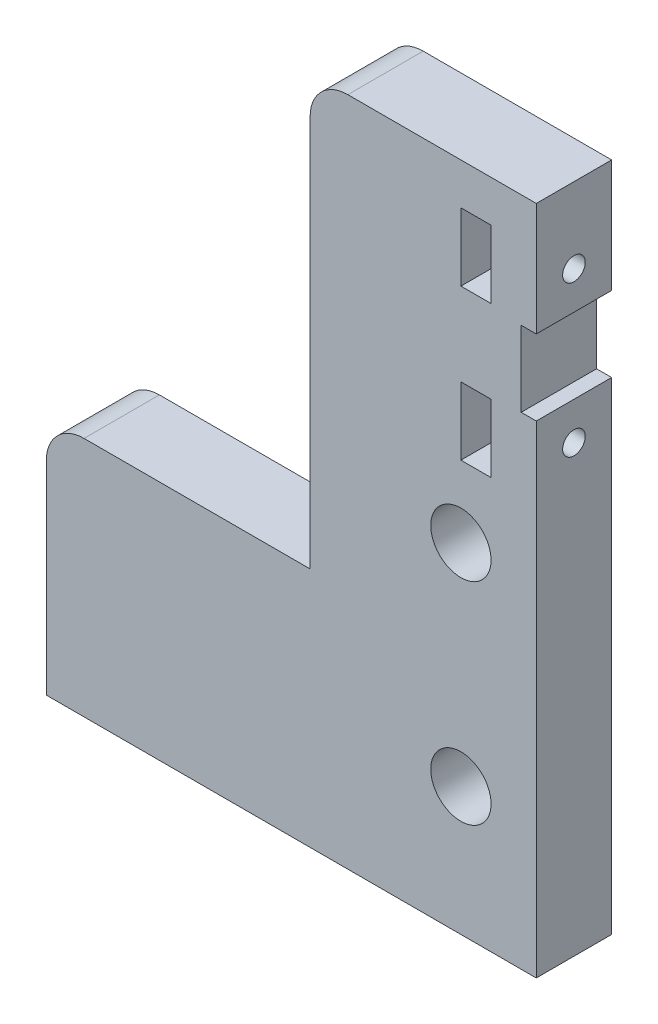
from build123d import *

# Parameters (mm, degrees)
SKETCH1_R           = 4
BOSS_EXTRUDE1_DEPTH = 10
SKETCH2_W           = 2
SKETCH2_H           = 10
CUT_EXTRUDE1_DEPTH  = 10
SKETCH3_R           = 1.5
CUT_EXTRUDE2_DEPTH  = 10
SKETCH4_W           = 4
SKETCH4_H           = 9
CUT_EXTRUDE3_DEPTH  = 10
SKETCH5_W           = 30
SKETCH5_H           = 10
BOSS_EXTRUDE2_DEPTH = 5
SKETCH6_R           = 8
CUT_EXTRUDE4_DEPTH  = 48
SKETCH7_R           = 6
CUT_EXTRUDE5_DEPTH  = 65
SKETCH8_R           = 6
CUT_EXTRUDE6_DEPTH  = 16
BOSS_EXTRUDE3_DEPTH = 15
SKETCH10_R          = 6
CUT_EXTRUDE7_DEPTH  = 6
FILLET1_R           = 5
FILLET2_R           = 5


with BuildPart() as part:
    # Sketch1 → Boss-Extrude1 (new body)
    with BuildSketch(Plane.XY):
        Polygon((0, 0), (30, 0), (30, -84), (-35, -84), (-35, -52), (0, -52), align=None)
        with Locations((20, -39)):
            Circle(SKETCH1_R, mode=Mode.SUBTRACT)
        with Locations((20, -67)):
            Circle(SKETCH1_R, mode=Mode.SUBTRACT)
    extrude(amount=BOSS_EXTRUDE1_DEPTH)

    # Sketch2 → Cut-Extrude1 (cut)
    with BuildSketch(Plane.XY.offset(10)):
        with Locations((29, -15)):
            Rectangle(SKETCH2_W, SKETCH2_H)
    extrude(amount=-CUT_EXTRUDE1_DEPTH, mode=Mode.SUBTRACT)

    # Sketch3 → Cut-Extrude2 (cut)
    with BuildSketch(Plane(origin=(30, 0, 0), x_dir=(0, 0, -1), z_dir=(1, 0, 0))):
        with Locations(Location((-5, -5, 0), (0, 0, 90))):
            Circle(SKETCH3_R)
        with Locations(Location((-5, -25, 0), (0, 0, 90))):
            Circle(SKETCH3_R)
    extrude(amount=-CUT_EXTRUDE2_DEPTH, mode=Mode.SUBTRACT)

    # Sketch4 → Cut-Extrude3 (cut)
    with BuildSketch(Plane.XY.offset(10)):
        with Locations((22, -5)):
            Rectangle(SKETCH4_W, SKETCH4_H)
        with Locations((22, -25)):
            Rectangle(SKETCH4_W, SKETCH4_H)
    extrude(amount=-CUT_EXTRUDE3_DEPTH, mode=Mode.SUBTRACT)

    # Sketch5 → Boss-Extrude2 (add)
    with BuildSketch(Plane(origin=(0, 0, 0), x_dir=(1, 0, 0), z_dir=(0, 1, 0))):
        with Locations((15, -5)):
            Rectangle(SKETCH5_W, SKETCH5_H)
    extrude(amount=BOSS_EXTRUDE2_DEPTH)

    # Sketch6 → Cut-Extrude4 (cut)
    with BuildSketch(Plane.ZY.offset(35)):
        with Locations((0, -68)):
            Circle(SKETCH6_R)
    extrude(amount=-CUT_EXTRUDE4_DEPTH, mode=Mode.SUBTRACT)

    # Sketch7 → Cut-Extrude5 (cut)
    with BuildSketch(Plane(origin=(0, 5, 0), x_dir=(1, 0, 0), z_dir=(0, 1, 0))):
        with Locations((7, 0)):
            Circle(SKETCH7_R)
    extrude(amount=-CUT_EXTRUDE5_DEPTH, mode=Mode.SUBTRACT)

    # Sketch8 → Cut-Extrude6 (cut)
    with BuildSketch(Plane(origin=(0, -60, 0), x_dir=(1, 0, 0), z_dir=(0, 1, 0))):
        with Locations((7, 0)):
            Circle(SKETCH8_R)
    extrude(amount=-CUT_EXTRUDE6_DEPTH, mode=Mode.SUBTRACT)

    # Sketch9 → Boss-Extrude3 (add)
    with BuildSketch(Plane(origin=(0, 5, 0), x_dir=(1, 0, 0), z_dir=(0, 1, 0))):
        with BuildLine():
            Line((13, 0), (1, 0))
            ThreePointArc((1, 0), (7, -6), (13, 0))
        make_face()
    extrude(amount=-BOSS_EXTRUDE3_DEPTH)

    # Sketch10 → Cut-Extrude7 (cut)
    with BuildSketch(Plane(origin=(0, 0, 0), x_dir=(-1, 0, 0), z_dir=(0, 0, -1))):
        with Locations((-7, -10)):
            Circle(SKETCH10_R)
    extrude(amount=-CUT_EXTRUDE7_DEPTH, mode=Mode.SUBTRACT)

    # Fillet1
    fillet1_edges = [part.edges().sort_by_distance(p)[0] for p in [
        (-35, -52, 5),
    ]]
    fillet(fillet1_edges, radius=FILLET1_R)

    # Fillet2
    fillet2_edges = [part.edges().sort_by_distance(p)[0] for p in [
        (0, 5, 5),
    ]]
    fillet(fillet2_edges, radius=FILLET2_R)


solid = part.part
